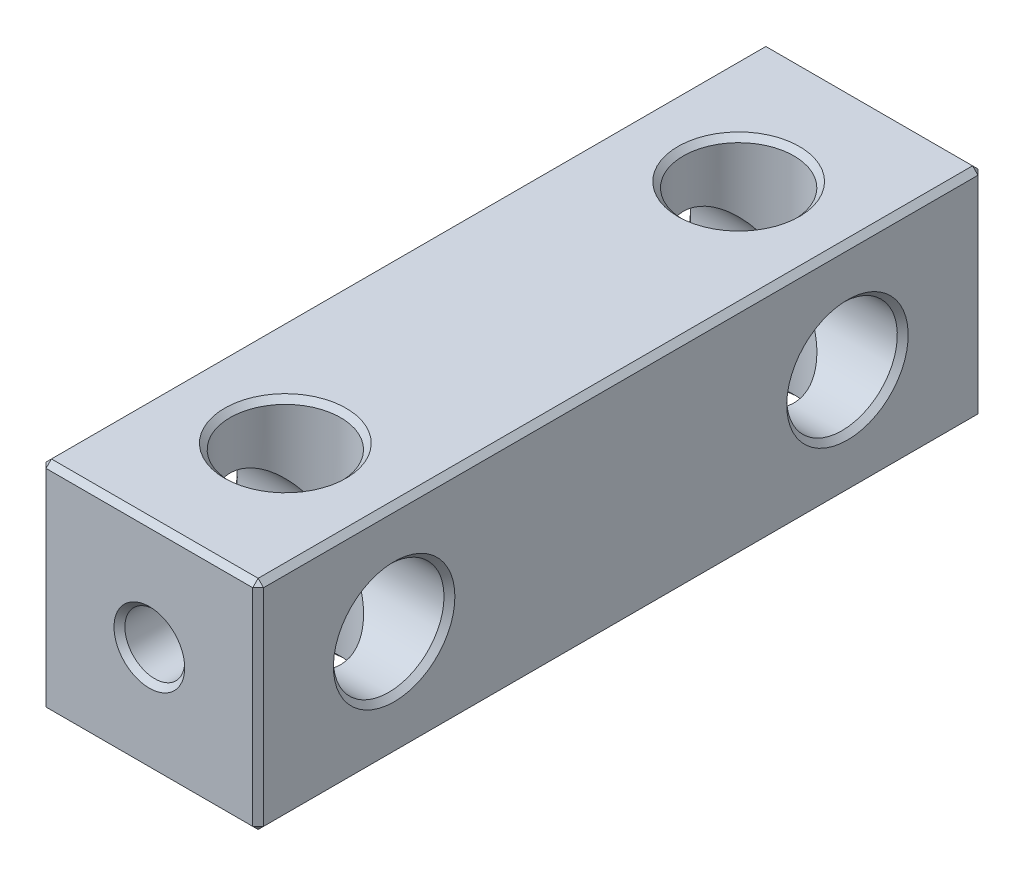
from build123d import *

# Parameters (mm, degrees)
SKETCH_1_W              = 12
SKETCH_1_H              = 12
EXTRUDE_1_DEPTH         = 20
HOLE_WIZARD_6_1_6_1_1_D = 6.1
HOLE_WIZARD_6_1_6_1_2_D = 6.1
HOLE_WIZARD_M4_1_REACH  = 42.89
HOLE_WIZARD_M4_1_BORE_R = 1.65
HOLE_WIZARD_M4_2_REACH  = 42.89
HOLE_WIZARD_M4_2_BORE_R = 1.65
CHAMFER_1_SIZE          = 0.3


with BuildPart() as part:
    # 草图1 → 凸台-拉伸1 (new, symmetric)
    with BuildSketch(Plane.XY):
        Rectangle(SKETCH_1_W, SKETCH_1_H)
    extrude(amount=EXTRUDE_1_DEPTH, both=True)

    # Ø6.1 (6.1) 直径孔1 (through all)
    with Locations(Plane(origin=(6, 0, 0), x_dir=(0, 0, -1), z_dir=(1, 0, 0))):
        with Locations((-12.5, 0), (12.5, 0)):
            Hole(HOLE_WIZARD_6_1_6_1_1_D / 2)

    # Ø6.1 (6.1) 直径孔2 (through all)
    with Locations(Plane(origin=(0, 6, 0), x_dir=(1, 0, 0), z_dir=(0, 1, 0))):
        with Locations((0, -12.5), (0, 12.5)):
            Hole(HOLE_WIZARD_6_1_6_1_2_D / 2)

    # M4 螺纹孔1 bore → M4 螺纹孔1 (cut, up to next)
    with BuildSketch(Plane.XY.offset(20), mode=Mode.PRIVATE) as hole_wizard_m4_1_sk1:
        Circle(HOLE_WIZARD_M4_1_BORE_R)
    hole_wizard_m4_1_tool1 = extrude(hole_wizard_m4_1_sk1.sketch, amount=-HOLE_WIZARD_M4_1_REACH, mode=Mode.PRIVATE) & part.part
    add(hole_wizard_m4_1_tool1.solids().sort_by_distance((0, 0, 20))[0], mode=Mode.SUBTRACT)

    # M4 螺纹孔2 bore → M4 螺纹孔2 (cut, up to next)
    with BuildSketch(Plane(origin=(0, 0, -20), x_dir=(-1, 0, 0), z_dir=(0, 0, -1)), mode=Mode.PRIVATE) as hole_wizard_m4_2_sk1:
        Circle(HOLE_WIZARD_M4_2_BORE_R)
    hole_wizard_m4_2_tool1 = extrude(hole_wizard_m4_2_sk1.sketch, amount=-HOLE_WIZARD_M4_2_REACH, mode=Mode.PRIVATE) & part.part
    add(hole_wizard_m4_2_tool1.solids().sort_by_distance((0, 0, -20))[0], mode=Mode.SUBTRACT)

    # 倒角1
    chamfer_1_edges = [part.edges().sort_by_distance(p)[0] for p in [
        (-6, 0, 20),
        (6, 0, -15.55),
        (-6, 0, -15.55),
        (0, -6, 20),
        (6, 0, 9.45),
        (-6, 0, 9.45),
        (3.05, -6, -12.5),
        (3.05, 6, -12.5),
        (3.05, -6, 12.5),
        (3.05, 6, 12.5),
        (6, 0, 20),
        (0, -6, -20),
        (-6, 0, -20),
        (-1.65, 0, 20),
        (0, 6, -20),
        (6, 0, -20),
        (1.65, 0, -20),
        (6, -6, 0),
        (-6, -6, 0),
        (-6, 6, 0),
        (6, 6, 0),
        (0, 6, 20),
    ]]
    chamfer(chamfer_1_edges, length=CHAMFER_1_SIZE)


solid = part.part
